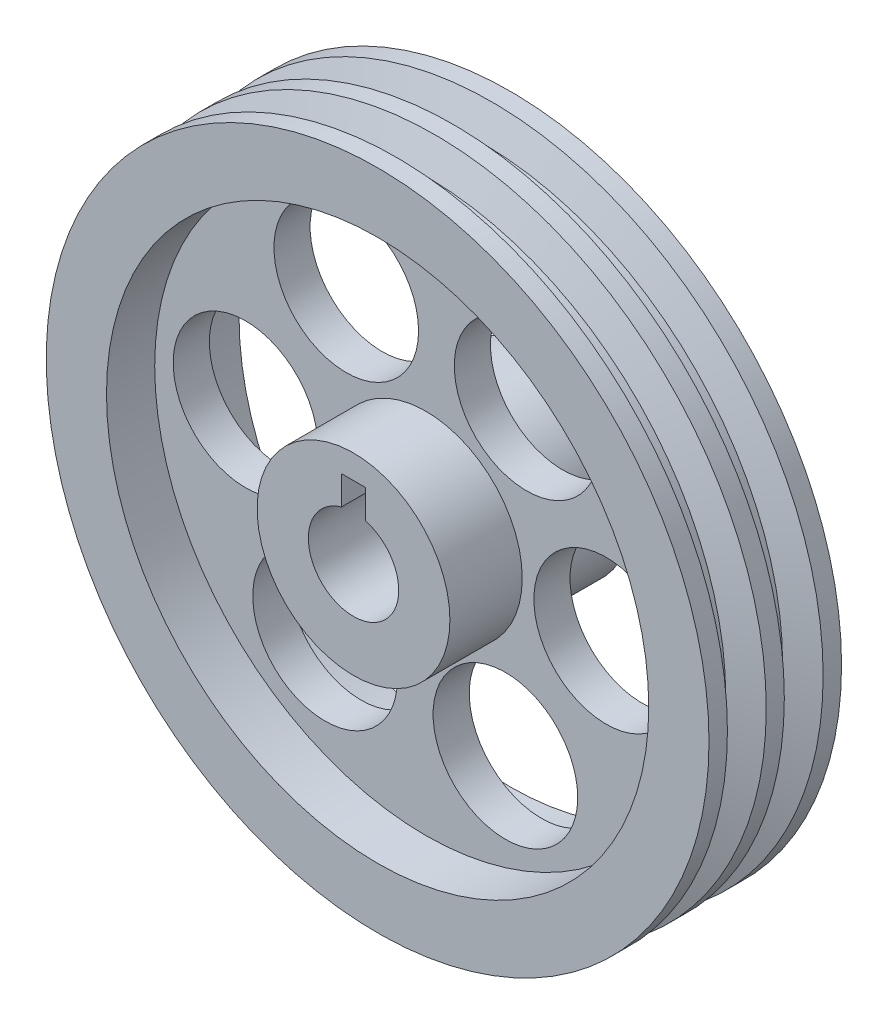
from build123d import *

# Parameters (mm, degrees)
SKETCH_1_R      = 16
EXTRUDE_1_DEPTH = 15
SKETCH_1_3_R    = 45
SKETCH_1_3_R_2  = 12
SKETCH_1_3_R_3  = 16
EXTRUDE_2_DEPTH = 3
SKETCH_1_4_R    = 55
SKETCH_1_4_R_2  = 45
EXTRUDE_3_DEPTH = 11


with BuildPart() as part:
    # 草图1 → 凸台-拉伸1 (new, symmetric)
    with BuildSketch(Plane.XY):
        Circle(SKETCH_1_R)
        with BuildLine():
            Line((-2, 12.022916711), (0, 12.022916711))
            Line((0, 12.022916711), (2, 12.022916711))
            Line((2, 12.022916711), (2, 7.228416147))
            ThreePointArc((2, 7.228416147), (0, -7.5), (-2, 7.228416147))
            Line((-2, 7.228416147), (-2, 12.022916711))
        make_face(mode=Mode.SUBTRACT)
    extrude(amount=EXTRUDE_1_DEPTH, both=True)

    # 草图1<3> → 凸台-拉伸2 (add, symmetric)
    with BuildSketch(Plane.XY):
        Circle(SKETCH_1_3_R)
        with Locations((-16.723776012, -24.906130087)):
            Circle(SKETCH_1_3_R_2, mode=Mode.SUBTRACT)
        with Locations((13.207453359, -26.936279917)):
            Circle(SKETCH_1_3_R_2, mode=Mode.SUBTRACT)
        with Locations((29.931229371, -2.03014983)):
            Circle(SKETCH_1_3_R_2, mode=Mode.SUBTRACT)
        with Locations((-29.931229371, 2.03014983)):
            Circle(SKETCH_1_3_R_2, mode=Mode.SUBTRACT)
        with Locations((-13.207453359, 26.936279917)):
            Circle(SKETCH_1_3_R_2, mode=Mode.SUBTRACT)
        Circle(SKETCH_1_3_R_3, mode=Mode.SUBTRACT)
        with Locations((16.723776012, 24.906130087)):
            Circle(SKETCH_1_3_R_2, mode=Mode.SUBTRACT)
    extrude(amount=EXTRUDE_2_DEPTH, both=True)

    # 草图1<4> → 凸台-拉伸3 (add, symmetric)
    with BuildSketch(Plane.XY):
        Circle(SKETCH_1_4_R)
        Circle(SKETCH_1_4_R_2, mode=Mode.SUBTRACT)
    extrude(amount=EXTRUDE_3_DEPTH, both=True)

    # 草图2 → 切除-旋转2 (revolve, cut)
    with BuildSketch(Plane(origin=(0, 0, 0), x_dir=(0, 0, -1), z_dir=(1, 0, 0))):
        Polygon((-1.5, 55), (-7.943276133, 55), (-6.221638066, 50), (-3.221638066, 50), align=None)
        Polygon((7.943276133, 55), (1.5, 55), (3.221638066, 50), (6.221638066, 50), align=None)
    revolve(axis=Axis((0, 0, 17.503748609), (0, 0, -1)), mode=Mode.SUBTRACT)


solid = part.part
